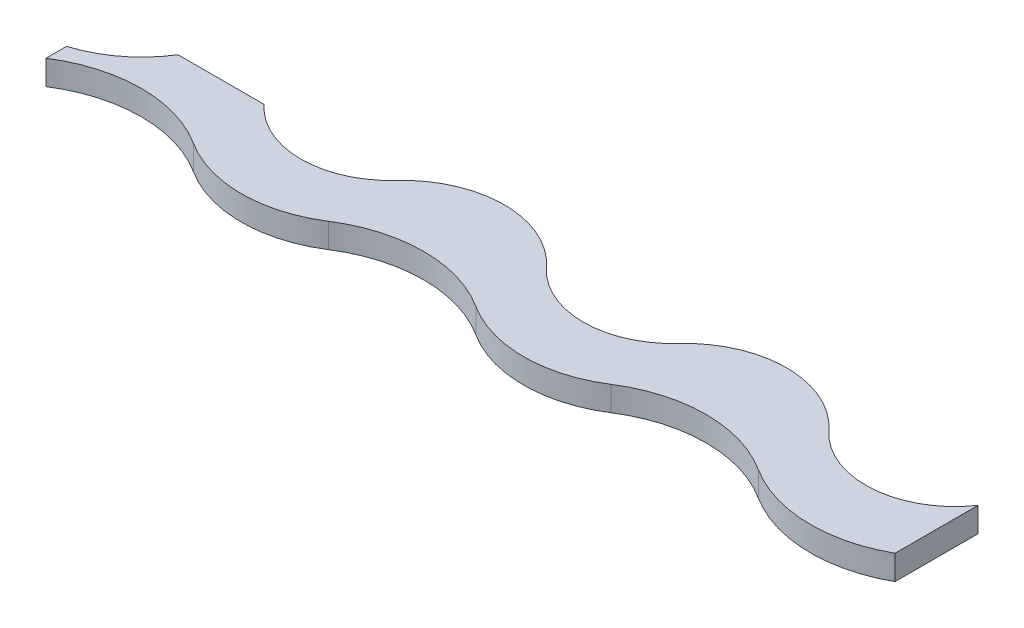
from build123d import *

# Parameters (mm, degrees)
BOSS_EXTRUDE1_DEPTH = 2


with BuildPart() as part:
    # Sketch2 → Boss-Extrude1 (new body)
    with BuildSketch(Plane(origin=(0, 0, 0), x_dir=(1, 0, 0), z_dir=(0, 1, 0))):
        with BuildLine():
            Line((63.346978543, 15.774727996), (63.346978543, 9.034727996))
            ThreePointArc((63.346978543, 9.034727996), (57.571540875, 7.622708087), (51.89, 9.374727996))
            ThreePointArc((51.89, 9.374727996), (45.9, 11.125), (39.91, 9.374727996))
            ThreePointArc((39.91, 9.374727996), (34.425, 7.772016487), (28.94, 9.374727996))
            ThreePointArc((28.94, 9.374727996), (22.95, 11.125), (16.96, 9.374727996))
            ThreePointArc((16.96, 9.374727996), (11.475, 7.772016487), (5.99, 9.374727996))
            ThreePointArc((5.99, 9.374727996), (0, 11.125), (-5.99, 9.374727996))
            Line((-5.99, 9.374727996), (-5.99, 11.044727996))
            ThreePointArc((-5.99, 11.044727996), (-3.073533572, 12.552842644), (-0.867605229, 14.984727996))
            Line((-0.867605229, 14.984727996), (6.120538735, 14.984727996))
            ThreePointArc((6.120538735, 14.984727996), (11.47, 12.62816893), (16.819461265, 14.984727996))
            ThreePointArc((16.819461265, 14.984727996), (22.945, 17.683166797), (29.070538735, 14.984727996))
            ThreePointArc((29.070538735, 14.984727996), (34.42, 12.62816893), (39.769461265, 14.984727996))
            ThreePointArc((39.769461265, 14.984727996), (45.895, 17.683166797), (52.020538735, 14.984727996))
            ThreePointArc((52.020538735, 14.984727996), (57.874449684, 12.645739842), (63.346978543, 15.774727996))
        make_face()
    extrude(amount=BOSS_EXTRUDE1_DEPTH)


solid = part.part
